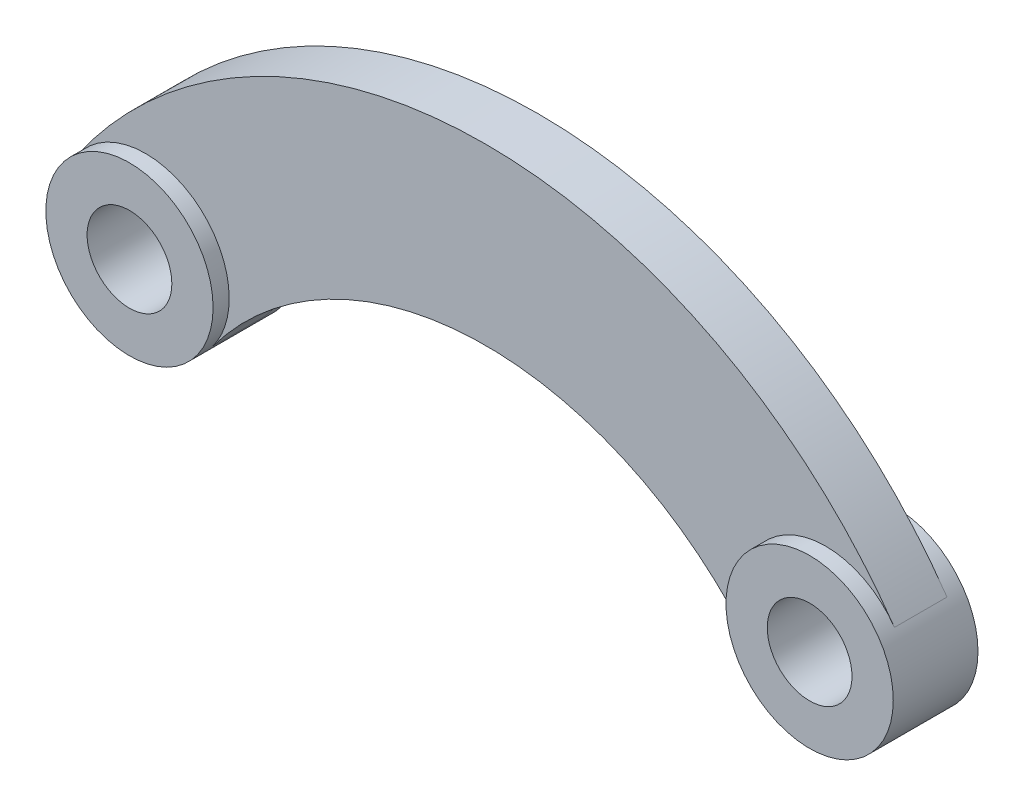
from build123d import *

# Parameters (mm, degrees)
SKETCH1_R             = 75
SKETCH1_R_2           = 38
BOSS_EXTRUDE1_DEPTH   = 38
BOSS_EXTRUDE1_2_DEPTH = 38
BOSS_EXTRUDE2_DEPTH   = 23.574371523


with BuildPart() as part:
    # Sketch1 → Boss-Extrude1 (new, symmetric)
    with BuildSketch(Plane.XY):
        Circle(SKETCH1_R)
        Circle(SKETCH1_R_2, mode=Mode.SUBTRACT)
    extrude(amount=BOSS_EXTRUDE1_DEPTH, both=True)



with BuildPart() as body_2:
    # Sketch1 → Boss-Extrude1 2 (new, symmetric)
    with BuildSketch(Plane.XY):
        with Locations((610, 0)):
            Circle(SKETCH1_R)
        with Locations((610, 0)):
            Circle(SKETCH1_R_2, mode=Mode.SUBTRACT)
    extrude(amount=BOSS_EXTRUDE1_2_DEPTH, both=True)


with BuildPart() as part_1:
    add(part.part)

    add(body_2.part)  # Boss-Extrude2 merges body 2
    # Sketch2 → Boss-Extrude2 (add, symmetric)
    with BuildSketch(Plane.XY):
        with BuildLine():
            ThreePointArc((75, 0), (71.203239503, -23.560532341), (60.197368421, -44.735632724))
            ThreePointArc((60.197368421, -44.735632724), (305, 78.339460867), (549.802631579, -44.735632724))
            ThreePointArc((549.802631579, -44.735632724), (566.27585101, 60.936022147), (671.657681941, 42.700471399))
            ThreePointArc((671.657681941, 42.700471399), (305, 234.775001479), (-61.657681941, 42.700471399))
            ThreePointArc((-61.657681941, 42.700471399), (22.368212428, 71.586752076), (75, 0))
        make_face()
    extrude(amount=BOSS_EXTRUDE2_DEPTH, both=True)


solid = part_1.part
